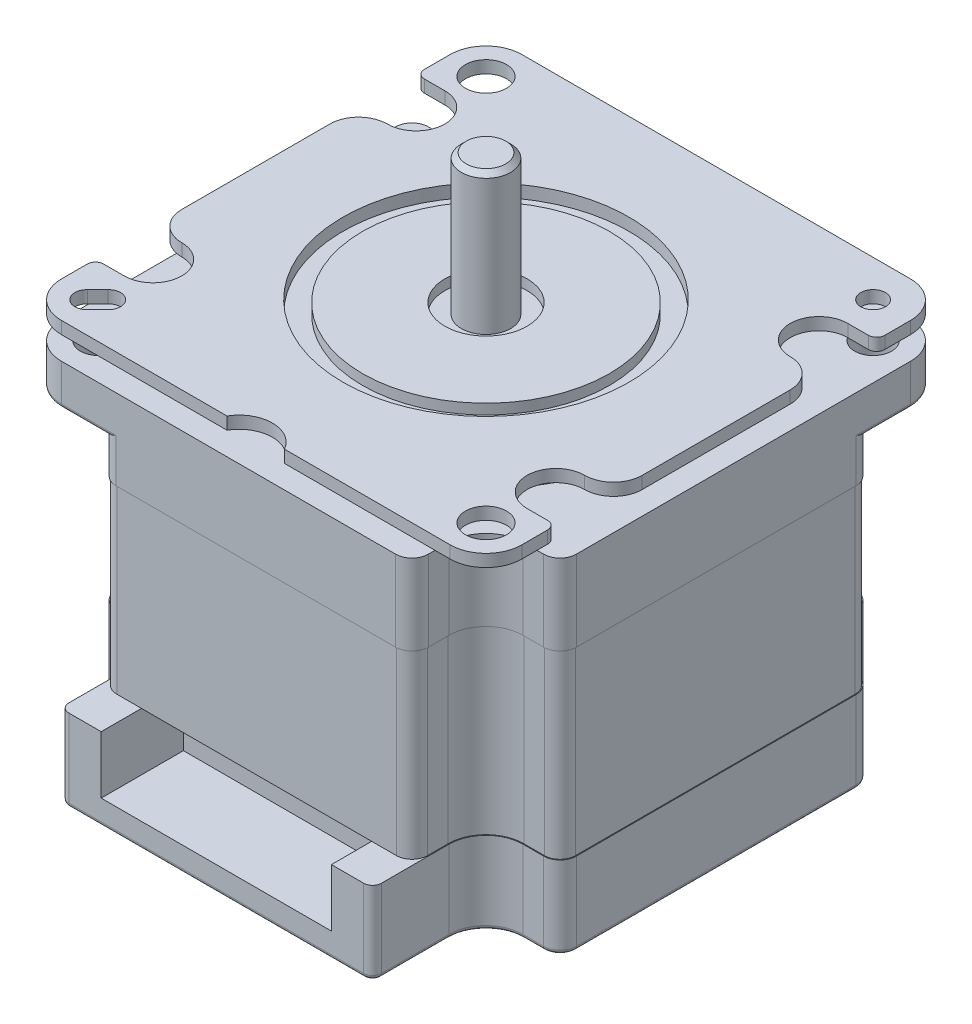
from build123d import *

# Parameters (mm, degrees)
SKETCH1_R                    = 2.5
SKETCH1_R_2                  = 1.5
SKETCH1_R_3                  = 17.4
BOSS_EXTRUDE1_DEPTH          = 1.5
SKETCH2_R                    = 2.25
BOSS_EXTRUDE2_DEPTH          = 5
BOSS_EXTRUDE3_DEPTH          = 4.8
BOSS_EXTRUDE4_DEPTH          = 22
BOSS_EXTRUDE6_DEPTH          = 10
SKETCH7_W                    = 28
SKETCH7_H                    = 7
CUT_EXTRUDE1_DEPTH           = 10
SKETCH8_R                    = 22
BOSS_EXTRUDE7_DEPTH          = 2.75
SKETCH9_R                    = 15
SKETCH9_R_2                  = 5
BOSS_EXTRUDE9_DEPTH          = 1.25
SKETCH10_R                   = 3
BOSS_EXTRUDE10_DEPTH         = 17.05
CHAMFER1_SIZE                = 0.6
SKETCH11_R                   = 16.5
SKETCH11_R_2                 = 14.1
CUT_EXTRUDE2_DEPTH           = 2.4
CUT_EXTRUDE2_DRAFT           = -5
SKETCH11_R_3                 = 4.9
CUT_EXTRUDE2_PROFILE_2_DEPTH = 2.4
CUT_EXTRUDE2_PROFILE_2_DRAFT = -5
FILLET1_R                    = 0.5


with BuildPart() as part:
    # Sketch1 → Boss-Extrude1 (new body)
    with BuildSketch(Plane(origin=(0, 0, 0), x_dir=(1, 0, 0), z_dir=(0, 1, 0))):
        with BuildLine():
            Line((-23.636488974, -28), (-3.5, -28))
            ThreePointArc((-3.5, -28), (0, -25.977387858), (3.5, -28))
            Line((3.5, -28), (23.636488974, -28))
            ThreePointArc((23.636488974, -28), (26.72195721, -26.72195721), (28, -23.636488974))
            Line((28, -23.636488974), (28, -20.500000005))
            ThreePointArc((28, -20.500000005), (27.707106781, -19.792893224), (27, -19.500000005))
            Line((27, -19.500000005), (24.500188769, -19.500000005))
            ThreePointArc((24.500188769, -19.500000005), (21.000188769, -16.000000005), (24.500188769, -12.500000005))
            ThreePointArc((24.500188769, -12.500000005), (26.974929023, -11.474929028), (28, -9.000188774))
            Line((28, -9.000188774), (28, 9.000188774))
            ThreePointArc((28, 9.000188774), (26.974929023, 11.474929028), (24.500188769, 12.500000005))
            ThreePointArc((24.500188769, 12.500000005), (21.000188769, 16.000000005), (24.500188769, 19.500000005))
            Line((24.500188769, 19.500000005), (27, 19.500000005))
            ThreePointArc((27, 19.500000005), (27.707106781, 19.792893224), (28, 20.500000005))
            Line((28, 20.500000005), (28, 23.636488974))
            ThreePointArc((28, 23.636488974), (26.72195721, 26.72195721), (23.636488974, 28))
            Line((23.636488974, 28), (-23.636488974, 28))
            ThreePointArc((-23.636488974, 28), (-26.72195721, 26.72195721), (-28, 23.636488974))
            Line((-28, 23.636488974), (-28, 20.500000005))
            ThreePointArc((-28, 20.500000005), (-27.707106781, 19.792893224), (-27, 19.500000005))
            Line((-27, 19.500000005), (-24.500188769, 19.500000005))
            ThreePointArc((-24.500188769, 19.500000005), (-21.000188769, 16.000000005), (-24.500188769, 12.500000005))
            ThreePointArc((-24.500188769, 12.500000005), (-26.974929023, 11.474929028), (-28, 9.000188774))
            Line((-28, 9.000188774), (-28, -9.000188774))
            ThreePointArc((-28, -9.000188774), (-26.974929023, -11.474929028), (-24.500188769, -12.500000005))
            ThreePointArc((-24.500188769, -12.500000005), (-21.000188769, -16.000000005), (-24.500188769, -19.500000005))
            Line((-24.500188769, -19.500000005), (-27, -19.500000005))
            ThreePointArc((-27, -19.500000005), (-27.707106781, -19.792893224), (-28, -20.500000005))
            Line((-28, -20.500000005), (-28, -23.636488974))
            ThreePointArc((-28, -23.636488974), (-26.72195721, -26.72195721), (-23.636488974, -28))
        make_face()
        with Locations(Location((-23.511300474, 23.511300474, 0), (0, 0, 270))):
            Circle(SKETCH1_R, mode=Mode.SUBTRACT)
        with Locations(Location((23.511300474, -23.511300474, 0), (0, 0, 90))):
            Circle(SKETCH1_R, mode=Mode.SUBTRACT)
        with Locations(Location((23.539976695, 23.539976695, 0), (0, 0, 270))):
            Circle(SKETCH1_R_2, mode=Mode.SUBTRACT)
        with Locations(Location((0, 0, 0), (0, 0, 270))):
            Circle(SKETCH1_R_3, mode=Mode.SUBTRACT)
        with BuildLine():
            Line((-25.307743648, -23.186423304), (-24.034951442, -21.913631098))
            ThreePointArc((-24.034951442, -21.913631098), (-21.913631098, -21.913631098), (-21.913631098, -24.034951442))
            Line((-21.913631098, -24.034951442), (-23.186423304, -25.307743648))
            ThreePointArc((-23.186423304, -25.307743648), (-25.307743648, -25.307743648), (-25.307743648, -23.186423304))
        make_face(mode=Mode.SUBTRACT)
    extrude(amount=BOSS_EXTRUDE1_DEPTH)


with BuildPart() as body_2:
    # Sketch2 → Boss-Extrude2 (new body)
    with BuildSketch(Plane(origin=(0, -2.8, 0), x_dir=(-1, 0, 0), z_dir=(0, -1, 0))):
        with BuildLine():
            Line((19, 26), (19, 23.5))
            ThreePointArc((19, 23.5), (20.318019485, 20.318019485), (23.5, 19))
            Line((23.5, 19), (26, 19))
            ThreePointArc((26, 19), (27.414213562, 18.414213562), (28, 17))
            Line((28, 17), (28, -23.636488974))
            ThreePointArc((28, -23.636488974), (26.72195721, -26.72195721), (23.636488974, -28))
            Line((23.636488974, -28), (-17, -28))
            ThreePointArc((-17, -28), (-18.414213562, -27.414213562), (-19, -26))
            Line((-19, -26), (-19, -23.5))
            ThreePointArc((-19, -23.5), (-20.318019485, -20.318019485), (-23.5, -19))
            Line((-23.5, -19), (-26, -19))
            ThreePointArc((-26, -19), (-27.414213562, -18.414213562), (-28, -17))
            Line((-28, -17), (-28, 23.636488974))
            ThreePointArc((-28, 23.636488974), (-26.72195721, 26.72195721), (-23.636488974, 28))
            Line((-23.636488974, 28), (17, 28))
            ThreePointArc((17, 28), (18.414213562, 27.414213562), (19, 26))
        make_face()
        with Locations(Location((-23.539976695, 23.539976695, 0), (0, 0, 90))):
            Circle(SKETCH2_R, mode=Mode.SUBTRACT)
        with Locations(Location((23.539976695, -23.539976695, 0), (0, 0, 270))):
            Circle(SKETCH2_R, mode=Mode.SUBTRACT)
    extrude(amount=BOSS_EXTRUDE2_DEPTH)

    # Sketch3 → Boss-Extrude3 (add)
    with BuildSketch(Plane.XZ.offset(7.8)):
        with BuildLine():
            Line((19, -26), (19, -23.5))
            ThreePointArc((19, -23.5), (20.318019485, -20.318019485), (23.5, -19))
            Line((23.5, -19), (26, -19))
            ThreePointArc((26, -19), (27.414213562, -18.414213562), (28, -17))
            Line((28, -17), (28, 17))
            ThreePointArc((28, 17), (27.414213562, 18.414213562), (26, 19))
            Line((26, 19), (23.5, 19))
            ThreePointArc((23.5, 19), (20.318019485, 20.318019485), (19, 23.5))
            Line((19, 23.5), (19, 26))
            ThreePointArc((19, 26), (18.414213562, 27.414213562), (17, 28))
            Line((17, 28), (-17, 28))
            ThreePointArc((-17, 28), (-18.414213562, 27.414213562), (-19, 26))
            Line((-19, 26), (-19, 23.5))
            ThreePointArc((-19, 23.5), (-20.318019485, 20.318019485), (-23.5, 19))
            Line((-23.5, 19), (-26, 19))
            ThreePointArc((-26, 19), (-27.414213562, 18.414213562), (-28, 17))
            Line((-28, 17), (-28, -17))
            ThreePointArc((-28, -17), (-27.414213562, -18.414213562), (-26, -19))
            Line((-26, -19), (-23.5, -19))
            ThreePointArc((-23.5, -19), (-20.318019485, -20.318019485), (-19, -23.5))
            Line((-19, -23.5), (-19, -26))
            ThreePointArc((-19, -26), (-18.414213562, -27.414213562), (-17, -28))
            Line((-17, -28), (17, -28))
            ThreePointArc((17, -28), (18.414213562, -27.414213562), (19, -26))
        make_face()
    extrude(amount=BOSS_EXTRUDE3_DEPTH)

    # Sketch4 → Boss-Extrude4 (add)
    with BuildSketch(Plane.XZ.offset(12.6)):
        with BuildLine():
            Line((23.5, -18.9), (26, -18.9))
            ThreePointArc((26, -18.9), (27.343502884, -18.343502884), (27.9, -17))
            Line((27.9, -17), (27.9, 17))
            ThreePointArc((27.9, 17), (27.343502884, 18.343502884), (26, 18.9))
            Line((26, 18.9), (23.5, 18.9))
            ThreePointArc((23.5, 18.9), (20.247308807, 20.247308807), (18.9, 23.5))
            Line((18.9, 23.5), (18.9, 26))
            ThreePointArc((18.9, 26), (18.343502884, 27.343502884), (17, 27.9))
            Line((17, 27.9), (-17, 27.9))
            ThreePointArc((-17, 27.9), (-18.343502884, 27.343502884), (-18.9, 26))
            Line((-18.9, 26), (-18.9, 23.5))
            ThreePointArc((-18.9, 23.5), (-20.247308807, 20.247308807), (-23.5, 18.9))
            Line((-23.5, 18.9), (-26, 18.9))
            ThreePointArc((-26, 18.9), (-27.343502884, 18.343502884), (-27.9, 17))
            Line((-27.9, 17), (-27.9, -17))
            ThreePointArc((-27.9, -17), (-27.343502884, -18.343502884), (-26, -18.9))
            Line((-26, -18.9), (-23.5, -18.9))
            ThreePointArc((-23.5, -18.9), (-20.247308807, -20.247308807), (-18.9, -23.5))
            Line((-18.9, -23.5), (-18.9, -26))
            ThreePointArc((-18.9, -26), (-18.343502884, -27.343502884), (-17, -27.9))
            Line((-17, -27.9), (17, -27.9))
            ThreePointArc((17, -27.9), (18.343502884, -27.343502884), (18.9, -26))
            Line((18.9, -26), (18.9, -23.5))
            ThreePointArc((18.9, -23.5), (20.247308807, -20.247308807), (23.5, -18.9))
        make_face()
    extrude(amount=BOSS_EXTRUDE4_DEPTH)

    # Sketch5 → Boss-Extrude6 (add)
    with BuildSketch(Plane.XZ.offset(34.6)):
        with BuildLine():
            Line((28, -17), (28, 17))
            ThreePointArc((28, 17), (27.414213562, 18.414213562), (26, 19))
            Line((26, 19), (23.5, 19))
            ThreePointArc((23.5, 19), (20.318019485, 20.318019485), (19, 23.5))
            Line((19, 23.5), (19, 31.729999364))
            ThreePointArc((19, 31.729999364), (18.68660407, 32.48660407), (17.929999364, 32.8))
            Line((17.929999364, 32.8), (-17.929999364, 32.8))
            ThreePointArc((-17.929999364, 32.8), (-18.68660407, 32.48660407), (-19, 31.729999364))
            Line((-19, 31.729999364), (-19, 23.5))
            ThreePointArc((-19, 23.5), (-20.318019485, 20.318019485), (-23.5, 19))
            Line((-23.5, 19), (-26, 19))
            ThreePointArc((-26, 19), (-27.414213562, 18.414213562), (-28, 17))
            Line((-28, 17), (-28, -17))
            ThreePointArc((-28, -17), (-27.414213562, -18.414213562), (-26, -19))
            Line((-26, -19), (-23.5, -19))
            ThreePointArc((-23.5, -19), (-20.318019485, -20.318019485), (-19, -23.5))
            Line((-19, -23.5), (-19, -26))
            ThreePointArc((-19, -26), (-18.414213562, -27.414213562), (-17, -28))
            Line((-17, -28), (17, -28))
            ThreePointArc((17, -28), (18.414213562, -27.414213562), (19, -26))
            Line((19, -26), (19, -23.5))
            ThreePointArc((19, -23.5), (20.318019485, -20.318019485), (23.5, -19))
            Line((23.5, -19), (26, -19))
            ThreePointArc((26, -19), (27.414213562, -18.414213562), (28, -17))
        make_face()
    extrude(amount=BOSS_EXTRUDE6_DEPTH)

    # Sketch7 → Cut-Extrude1 (cut)
    with BuildSketch(Plane.XY.offset(32.8)):
        with Locations((0, -38.1)):
            Rectangle(SKETCH7_W, SKETCH7_H)
    extrude(amount=-CUT_EXTRUDE1_DEPTH, mode=Mode.SUBTRACT)

    # Sketch8 → Boss-Extrude7 (add)
    with BuildSketch(Plane(origin=(0, -2.8, 0), x_dir=(1, 0, 0), z_dir=(0, 1, 0))):
        with Locations(Location((0, 0, 0), (0, 0, 90))):
            Circle(SKETCH8_R)
    extrude(amount=BOSS_EXTRUDE7_DEPTH)

    # Sketch9 → Boss-Extrude9 (add)
    with BuildSketch(Plane(origin=(0, -0.05, 0), x_dir=(1, 0, 0), z_dir=(0, 1, 0))):
        with Locations(Location((0, 0, 0), (0, 0, 270))):
            Circle(SKETCH9_R)
        with Locations(Location((0, 0, 0), (0, 0, 270))):
            Circle(SKETCH9_R_2, mode=Mode.SUBTRACT)
    extrude(amount=BOSS_EXTRUDE9_DEPTH)


with BuildPart() as body_3:
    # Sketch10 → Boss-Extrude10 (new body)
    with BuildSketch(Plane(origin=(0, -0.05, 0), x_dir=(1, 0, 0), z_dir=(0, 1, 0))):
        with Locations(Location((0, 0, 0), (0, 0, 270))):
            Circle(SKETCH10_R)
    extrude(amount=BOSS_EXTRUDE10_DEPTH)

    # Chamfer1
    chamfer1_edges = [body_3.edges().sort_by_distance(p)[0] for p in [
        (0, 17, -3),
    ]]
    chamfer(chamfer1_edges, length=CHAMFER1_SIZE)


with BuildPart() as cut_extrude2_tool:
    # Sketch11 → Cut-Extrude2 (with draft: the straight prism first)
    with BuildSketch(Plane.XZ.offset(44.6)):
        Circle(SKETCH11_R)
        Circle(SKETCH11_R_2, mode=Mode.SUBTRACT)
    extrude(amount=-CUT_EXTRUDE2_DEPTH)
    # Cut-Extrude2: the draft: its side faces are tilted about the plane it starts from
    cut_extrude2_sides = [cut_extrude2_tool.faces().sort_by_distance(p)[0] for p in [
        (-16.5, -43.4, 0),
        (-14.1, -43.4, 0),
    ]]
    draft(cut_extrude2_sides, Plane.XZ.offset(44.6), CUT_EXTRUDE2_DRAFT)


with BuildPart() as body_2_1:
    add(body_2.part)

    # Cut-Extrude2: cut by cut_extrude2_tool
    add(cut_extrude2_tool.part, mode=Mode.SUBTRACT)


with BuildPart() as cut_extrude2_profile_2_tool:
    # Sketch11 → Cut-Extrude2 profile 2 (with draft: the straight prism first)
    with BuildSketch(Plane.XZ.offset(44.6)):
        Circle(SKETCH11_R_3)
    extrude(amount=-CUT_EXTRUDE2_PROFILE_2_DEPTH)
    # Cut-Extrude2 profile 2: the draft: its side faces are tilted about the plane it starts from
    cut_extrude2_profile_2_sides = [cut_extrude2_profile_2_tool.faces().sort_by_distance(p)[0] for p in [
        (-4.9, -43.4, 0),
    ]]
    draft(cut_extrude2_profile_2_sides, Plane.XZ.offset(44.6), CUT_EXTRUDE2_PROFILE_2_DRAFT)


with BuildPart() as body_2_2:
    add(body_2_1.part)

    # Cut-Extrude2 profile 2: cut by cut_extrude2_profile_2_tool
    add(cut_extrude2_profile_2_tool.part, mode=Mode.SUBTRACT)

    # Fillet1
    fillet1_edges = [body_2_2.edges().sort_by_distance(p)[0] for p in [
        (-16.5, -44.6, 0),
        (-18.68660407, -44.6, 32.48660407),
        (-19, -44.6, 27.614999682),
        (-20.318019485, -44.6, 20.318019485),
        (-24.75, -44.6, 19),
        (-27.414213562, -44.6, 18.414213562),
        (-28, -44.6, 0),
        (-27.414213562, -44.6, -18.414213562),
        (-24.75, -44.6, -19),
        (-20.318019485, -44.6, -20.318019485),
        (-19, -44.6, -24.75),
        (-18.414213562, -44.6, -27.414213562),
        (0, -44.6, -28),
        (18.414213562, -44.6, -27.414213562),
        (19, -44.6, -24.75),
        (20.318019485, -44.6, -20.318019485),
        (24.75, -44.6, -19),
        (27.414213562, -44.6, -18.414213562),
        (28, -44.6, 0),
        (27.414213562, -44.6, 18.414213562),
        (24.75, -44.6, 19),
        (20.318019485, -44.6, 20.318019485),
        (19, -44.6, 27.614999682),
        (18.68660407, -44.6, 32.48660407),
        (0, -44.6, 32.8),
        (-4.9, -44.6, 0),
        (-14.1, -44.6, 0),
        (28, -7.8, -20.318244487),
        (26.72195721, -7.8, -26.72195721),
        (20.318244487, -7.8, -28),
        (-20.318244487, -7.8, 28),
        (-28, -7.8, 20.318244487),
        (-26.72195721, -7.8, 26.72195721),
    ]]
    fillet(fillet1_edges, radius=FILLET1_R)


solid = Compound([part.part, body_3.part, body_2_2.part])
